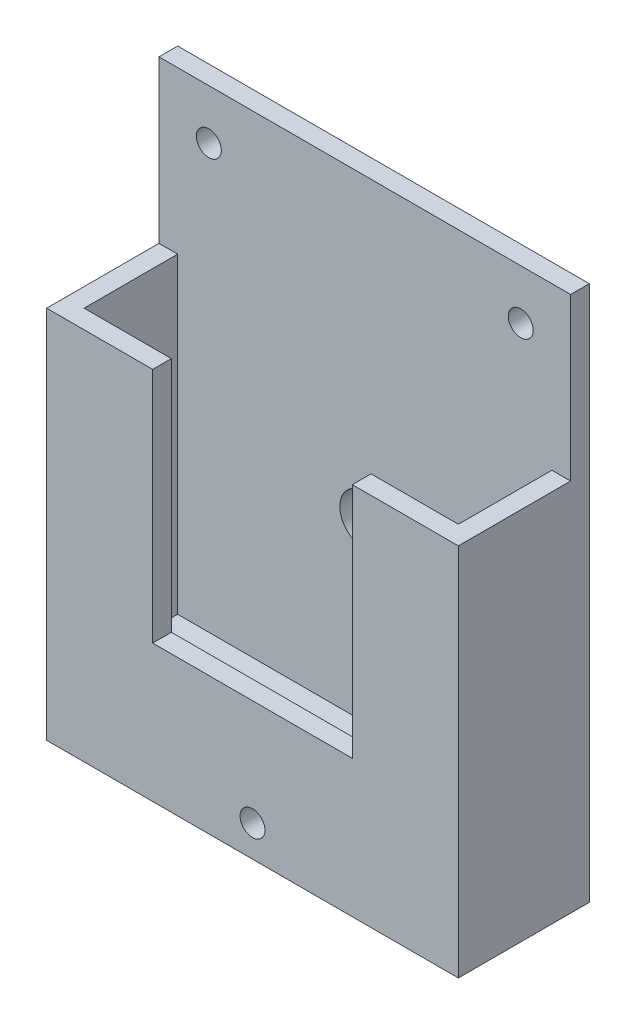
from build123d import *

# Parameters (mm, degrees)
BOSS_EXTRUDE1_DEPTH = 66
CUT_EXTRUDE1_START  = -3
SKETCH2_W           = 15
SKETCH2_H           = 50
CUT_EXTRUDE1_DEPTH  = 60
SKETCH3_W           = 32
SKETCH3_H           = 38
CUT_EXTRUDE2_DEPTH  = 110.812613119
SKETCH4_R           = 4
SKETCH4_R_2         = 2
CUT_EXTRUDE3_DEPTH  = 111.344052853


with BuildPart() as part:
    # Sketch1 → Boss-Extrude1 (new body)
    with BuildSketch(Plane(origin=(0, 0, 0), x_dir=(0, 0, -1), z_dir=(1, 0, 0))):
        Polygon((-3, -25.9), (-21, -25.9), (-21, -85.9), (0, -85.9), (0, 0), (-3, 0), align=None)
    extrude(amount=-BOSS_EXTRUDE1_DEPTH)

    # Sketch2 → Cut-Extrude1 (cut)
    with BuildSketch(Plane(origin=(0, 0, 0), x_dir=(0, 0, -1), z_dir=(1, 0, 0)).offset(CUT_EXTRUDE1_START)):
        with Locations((-10.5, -50.9)):
            Rectangle(SKETCH2_W, SKETCH2_H)
    extrude(amount=-CUT_EXTRUDE1_DEPTH, mode=Mode.SUBTRACT)

    # Sketch3 → Cut-Extrude2 (cut, through all)
    with BuildSketch(Plane.XY.offset(3)):
        with Locations((-33, -44.9)):
            Rectangle(SKETCH3_W, SKETCH3_H)
    extrude(amount=CUT_EXTRUDE2_DEPTH, mode=Mode.SUBTRACT)

    # Sketch4 → Cut-Extrude3 (cut, through all)
    with BuildSketch(Plane(origin=(0, 0, 0), x_dir=(-1, 0, 0), z_dir=(0, 0, -1))):
        with Locations((33, -47.9)):
            Circle(SKETCH4_R)
        with Locations((33, -80.9)):
            Circle(SKETCH4_R_2)
        with Locations((58, -8)):
            Circle(SKETCH4_R_2)
        with Locations((8, -8)):
            Circle(SKETCH4_R_2)
    extrude(amount=-CUT_EXTRUDE3_DEPTH, mode=Mode.SUBTRACT)


solid = part.part
